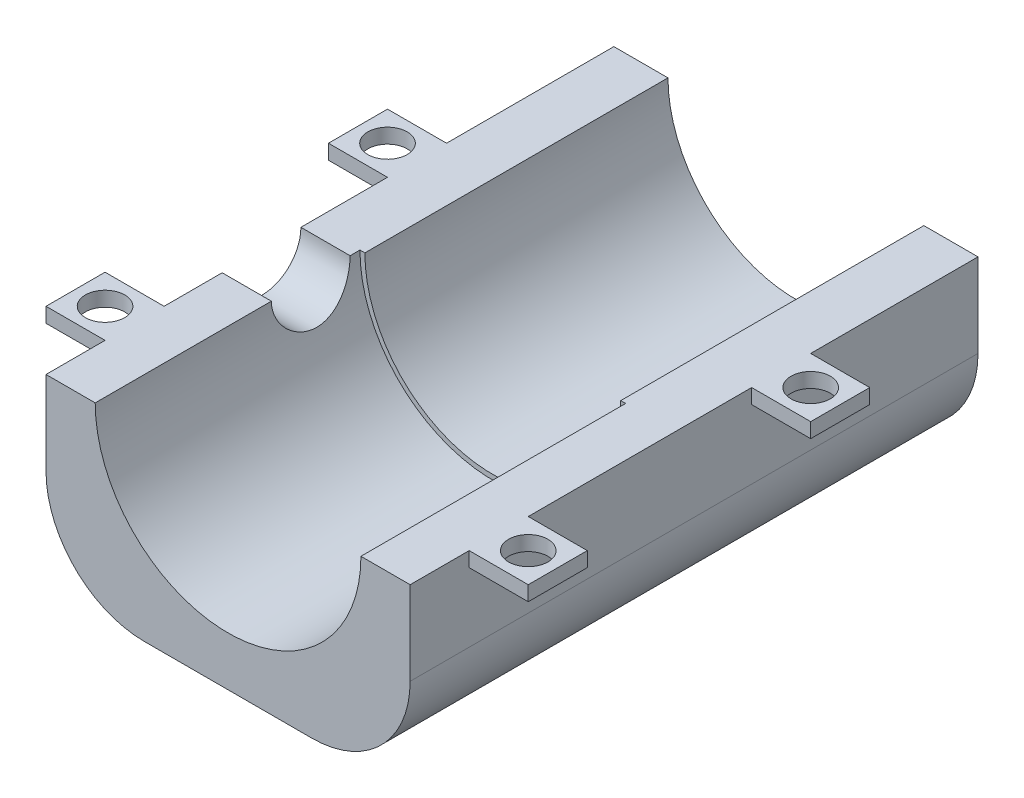
from build123d import *

# Parameters (mm, degrees)
EXTRUDE_1_DEPTH     = 57.7
EXTRUDE_2_DEPTH     = 30.8
SKETCH_5_R          = 4
CUT_EXTRUDE_1_DEPTH = 15
FILLET_1_R          = 10
SKETCH_6_W          = 6
SKETCH_6_H          = 1.5
EXTRUDE_3_DEPTH     = 6
EXTRUDE_START       = -37
SKETCH_6_3_W        = 6
SKETCH_6_3_H        = 1.5
EXTRUDE_4_DEPTH     = 6
SKETCH_7_R          = 2
CUT_EXTRUDE_2_DEPTH = 6
SKETCH_8_W          = 14.5
SKETCH_8_H          = 25.5
CUT_EXTRUDE_3_DEPTH = 2
SKETCH_9_R          = 13
CUT_EXTRUDE_4_DEPTH = 44.487239508


with BuildPart() as part:
    # 스케치1 → 보스-돌출1 (new body)
    with BuildSketch(Plane.XY):
        with BuildLine():
            Line((-13.5, 0), (-18.5, 0))
            Line((-18.5, 0), (-18.5, -18.5))
            Line((-18.5, -18.5), (18.5, -18.5))
            Line((18.5, -18.5), (18.5, 0))
            Line((18.5, 0), (13.5, 0))
            ThreePointArc((13.5, 0), (0, -13.5), (-13.5, 0))
        make_face()
    extrude(amount=-EXTRUDE_1_DEPTH)

    # 스케치3 → 보스-돌출2 (add)
    with BuildSketch(Plane.XY.offset(-26.9)):
        with BuildLine():
            Line((-13.5, 0), (-11.5, 0))
            ThreePointArc((-11.5, 0), (0, -11.5), (11.5, 0))
            Line((11.5, 0), (13.5, 0))
            ThreePointArc((13.5, 0), (0, -13.5), (-13.5, 0))
        make_face()
    extrude(amount=-EXTRUDE_2_DEPTH)

    # 스케치5 → 컷-돌출1 (cut)
    with BuildSketch(Plane.ZY.offset(18.5)):
        with Locations((-21.9, 0)):
            Circle(SKETCH_5_R)
    extrude(amount=-CUT_EXTRUDE_1_DEPTH, mode=Mode.SUBTRACT)

    # 필렛1
    fillet_1_edges = [part.edges().sort_by_distance(p)[0] for p in [
        (18.5, -18.5, -28.85),
        (-18.5, -18.5, -28.85),
    ]]
    fillet(fillet_1_edges, radius=FILLET_1_R)

    # 스케치6 → 보스-돌출3 (add)
    with BuildSketch(Plane(origin=(18.5, 0, 0), x_dir=(0, 0, -1), z_dir=(1, 0, 0))):
        with Locations((37.7, -0.75)):
            Rectangle(SKETCH_6_W, SKETCH_6_H)
        with Locations((9, -0.75)):
            Rectangle(SKETCH_6_W, SKETCH_6_H)
    extrude(amount=EXTRUDE_3_DEPTH)

    # 스케치6<3> → 보스-돌출4 (add)
    with BuildSketch(Plane(origin=(18.5, 0, 0), x_dir=(0, 0, -1), z_dir=(1, 0, 0)).offset(EXTRUDE_START)):
        with Locations((37.7, -0.75)):
            Rectangle(SKETCH_6_3_W, SKETCH_6_3_H)
        with Locations((9, -0.75)):
            Rectangle(SKETCH_6_3_W, SKETCH_6_3_H)
    extrude(amount=-EXTRUDE_4_DEPTH)

    # 스케치7 → 컷-돌출2 (cut)
    with BuildSketch(Plane(origin=(0, 0, 0), x_dir=(1, 0, 0), z_dir=(0, 1, 0))):
        with Locations(Location((21.5, 9, 0), (0, 0, 270))):
            Circle(SKETCH_7_R)
        with Locations(Location((21.5, 37.7, 0), (0, 0, 270))):
            Circle(SKETCH_7_R)
        with Locations(Location((-21.5, 9, 0), (0, 0, 180))):
            Circle(SKETCH_7_R)
        with Locations((-21.5, 37.7)):
            Circle(SKETCH_7_R)
    extrude(amount=-CUT_EXTRUDE_2_DEPTH, mode=Mode.SUBTRACT)

    # 스케치8 → 컷-돌출3 (cut)
    with BuildSketch(Plane.XZ.offset(18.5)):
        with Locations((0, -42.95)):
            Rectangle(SKETCH_8_W, SKETCH_8_H)
    extrude(amount=-CUT_EXTRUDE_3_DEPTH, mode=Mode.SUBTRACT)

    # 스케치9 → 컷-돌출4 (cut, through all)
    with BuildSketch(Plane.XY.offset(-26.9)):
        Circle(SKETCH_9_R)
    extrude(amount=-CUT_EXTRUDE_4_DEPTH, mode=Mode.SUBTRACT)


solid = part.part
